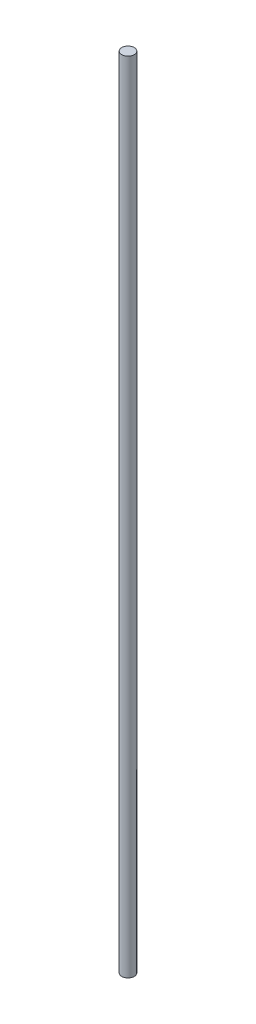
from build123d import *

# Parameters (mm, degrees)
SKETCH1_R           = 5
BOSS_EXTRUDE1_DEPTH = 640


with BuildPart() as part:
    # Sketch1 → Boss-Extrude1 (new body)
    with BuildSketch(Plane(origin=(0, 0, 0), x_dir=(1, 0, 0), z_dir=(0, 1, 0))):
        with Locations(Location((0, 0, 0), (0, 0, 270))):
            Circle(SKETCH1_R)
    extrude(amount=BOSS_EXTRUDE1_DEPTH)


solid = part.part
